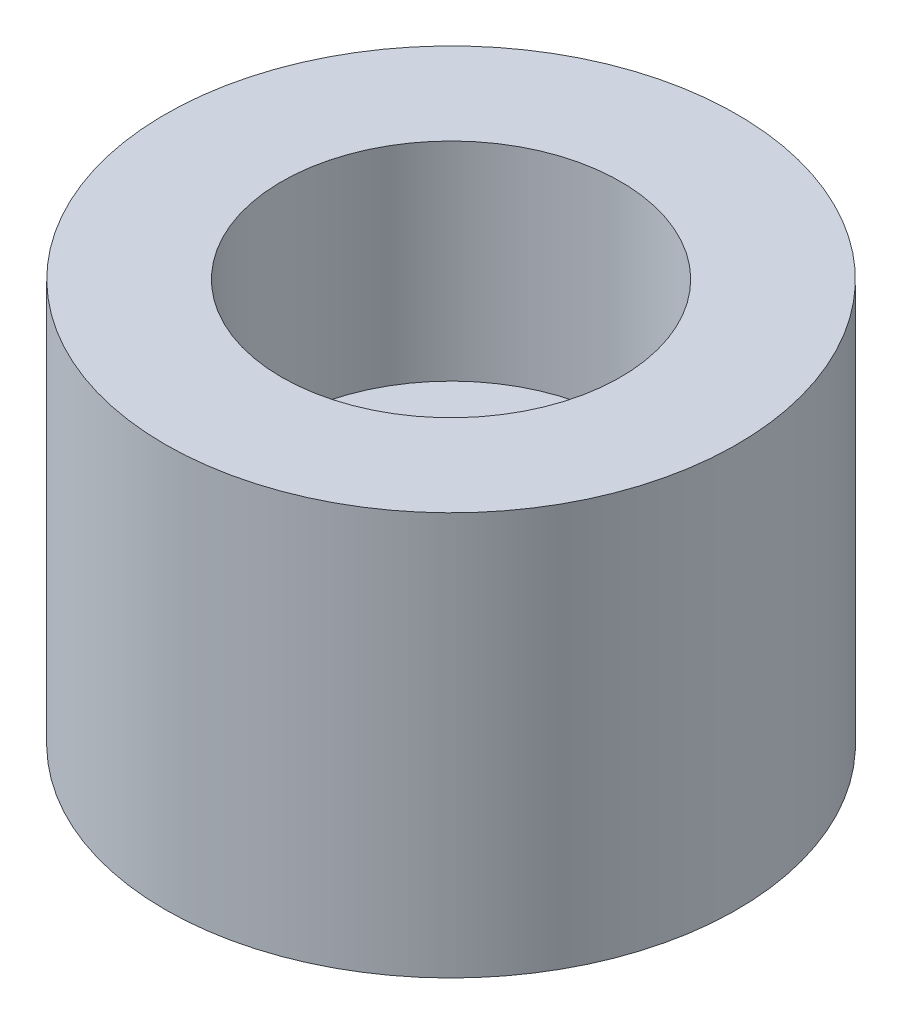
from build123d import *

# Parameters (mm, degrees)
SKETCH1_R           = 27.5
SKETCH1_R_2         = 23.9
BOSS_EXTRUDE1_DEPTH = 10.75
SKETCH2_R           = 27.5
SKETCH2_R_2         = 21.5
BOSS_EXTRUDE2_DEPTH = 3
SKETCH3_R           = 27.5
BOSS_EXTRUDE3_DEPTH = 5
SKETCH4_R           = 27.5
SKETCH4_R_2         = 16.3
BOSS_EXTRUDE4_DEPTH = 20


with BuildPart() as part:
    # Sketch1 → Boss-Extrude1 (new body)
    with BuildSketch(Plane(origin=(0, 0, 0), x_dir=(1, 0, 0), z_dir=(0, 1, 0))):
        with Locations(Location((0, 0, 0), (0, 0, 270))):
            Circle(SKETCH1_R)
        with Locations(Location((0, 0, 0), (0, 0, 270))):
            Circle(SKETCH1_R_2, mode=Mode.SUBTRACT)
    extrude(amount=BOSS_EXTRUDE1_DEPTH)

    # Sketch2 → Boss-Extrude2 (add)
    with BuildSketch(Plane(origin=(0, 10.75, 0), x_dir=(1, 0, 0), z_dir=(0, 1, 0))):
        with Locations(Location((0, 0, 0), (0, 0, 270))):
            Circle(SKETCH2_R)
        with Locations(Location((0, 0, 0), (0, 0, 270))):
            Circle(SKETCH2_R_2, mode=Mode.SUBTRACT)
    extrude(amount=BOSS_EXTRUDE2_DEPTH)

    # Sketch3 → Boss-Extrude3 (add)
    with BuildSketch(Plane(origin=(0, 13.75, 0), x_dir=(1, 0, 0), z_dir=(0, 1, 0))):
        with Locations(Location((0, 0, 0), (0, 0, 270))):
            Circle(SKETCH3_R)
    extrude(amount=BOSS_EXTRUDE3_DEPTH)

    # Sketch4 → Boss-Extrude4 (add)
    with BuildSketch(Plane(origin=(0, 18.75, 0), x_dir=(1, 0, 0), z_dir=(0, 1, 0))):
        with Locations(Location((0, 0, 0), (0, 0, 270))):
            Circle(SKETCH4_R)
        with Locations(Location((0, 0, 0), (0, 0, 270))):
            Circle(SKETCH4_R_2, mode=Mode.SUBTRACT)
    extrude(amount=BOSS_EXTRUDE4_DEPTH)


solid = part.part
